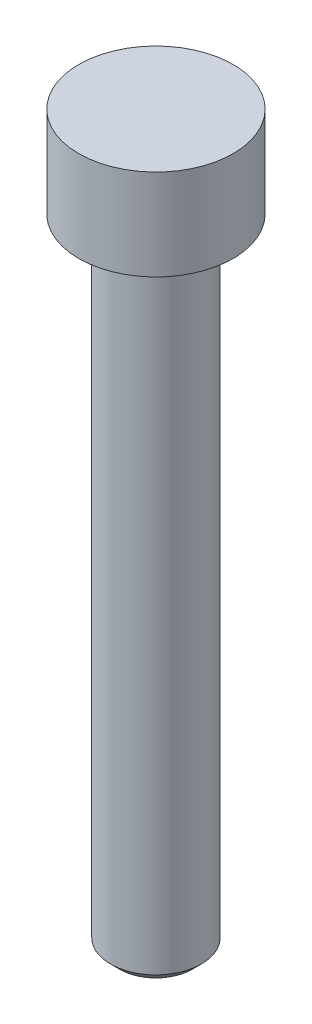
from build123d import *

# Parameters (mm, degrees)
SKETCH1_R           = 4.25
BOSS_EXTRUDE1_DEPTH = 5
SKETCH2_R           = 2.5
BOSS_EXTRUDE2_DEPTH = 35
CHAMFER1_SIZE       = 0.5


with BuildPart() as part:
    # Sketch1 → Boss-Extrude1 (new body)
    with BuildSketch(Plane(origin=(0, 0, 0), x_dir=(1, 0, 0), z_dir=(0, 1, 0))):
        with Locations(Location((0, 0, 0), (0, 0, 270))):
            Circle(SKETCH1_R)
    extrude(amount=BOSS_EXTRUDE1_DEPTH)

    # Sketch2 → Boss-Extrude2 (add)
    with BuildSketch(Plane.XZ):
        with Locations(Location((0, 0, 0), (0, 0, 270))):
            Circle(SKETCH2_R)
    extrude(amount=BOSS_EXTRUDE2_DEPTH)

    # Chamfer1
    chamfer1_edges = [part.edges().sort_by_distance(p)[0] for p in [
        (0, -35, 2.5),
    ]]
    chamfer(chamfer1_edges, length=CHAMFER1_SIZE)


solid = part.part
